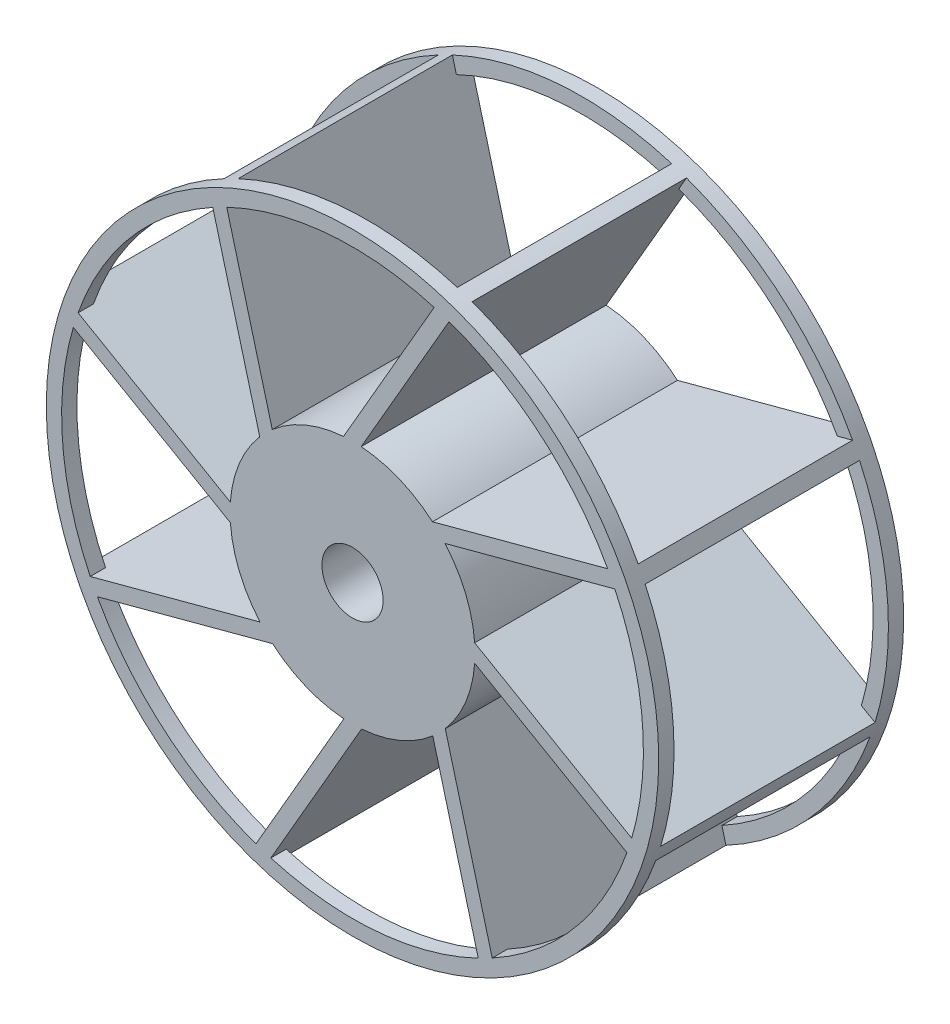
from build123d import *

# Parameters (mm, degrees)
SKETCH1_R           = 6.35
BOSS_EXTRUDE1_DEPTH = 50.8
BOSS_EXTRUDE2_START = -3.175
SKETCH2_R           = 63.5
SKETCH2_R_2         = 60.325
BOSS_EXTRUDE2_DEPTH = 3.175
SKETCH6_R           = 63.5
SKETCH6_R_2         = 60.325
BOSS_EXTRUDE3_DEPTH = 3.175
SKETCH1_3_R         = 6.35
CUT_EXTRUDE1_DEPTH  = 50.8


with BuildPart() as part:
    # Sketch1 → Boss-Extrude1 (new body)
    with BuildSketch(Plane.XY):
        Circle(SKETCH1_R)
        with BuildLine():
            Line((59.700240967, -21.63634046), (25.336398074, -1.796366515))
            ThreePointArc((25.336398074, -1.796366515), (-25.399970938, -0.03842333), (25.330847289, 1.873012441))
            Line((25.330847289, 1.873012441), (60.726284541, -18.562552784))
            ThreePointArc((60.726284541, -18.562552784), (60.232873534, -20.105992785), (59.700240967, -21.63634046))
        make_face()
        with BuildLine():
            Line((26.915242167, -57.513648286), (16.645315944, -19.185761833))
            ThreePointArc((16.645315944, -19.185761833), (-17.987661089, 17.933322295), (19.23603369, -16.587194093))
            Line((19.23603369, -16.587194093), (29.814260645, -56.065674545))
            ThreePointArc((29.814260645, -56.065674545), (28.373989485, -56.808157167), (26.915242167, -57.513648286))
        make_face()
        with BuildLine():
            Line((-21.63634046, -59.700240967), (-1.796366515, -25.336398074))
            ThreePointArc((-1.796366515, -25.336398074), (-0.03842333, 25.399970938), (1.873012441, -25.330847289))
            Line((1.873012441, -25.330847289), (-18.562552784, -60.726284541))
            ThreePointArc((-18.562552784, -60.726284541), (-20.105992785, -60.232873534), (-21.63634046, -59.700240967))
        make_face()
        with BuildLine():
            Line((-57.513648286, -26.915242167), (-19.185761833, -16.645315944))
            ThreePointArc((-19.185761833, -16.645315944), (17.933322295, 17.987661089), (-16.587194093, -19.23603369))
            Line((-16.587194093, -19.23603369), (-56.065674545, -29.814260645))
            ThreePointArc((-56.065674545, -29.814260645), (-56.808157167, -28.373989485), (-57.513648286, -26.915242167))
        make_face()
        with BuildLine():
            Line((-59.700240967, 21.63634046), (-25.336398074, 1.796366515))
            ThreePointArc((-25.336398074, 1.796366515), (25.399970938, 0.03842333), (-25.330847289, -1.873012441))
            Line((-25.330847289, -1.873012441), (-60.726284541, 18.562552784))
            ThreePointArc((-60.726284541, 18.562552784), (-60.232873534, 20.105992785), (-59.700240967, 21.63634046))
        make_face()
        with BuildLine():
            Line((-26.915242167, 57.513648286), (-16.645315944, 19.185761833))
            ThreePointArc((-16.645315944, 19.185761833), (17.987661089, -17.933322295), (-19.23603369, 16.587194093))
            Line((-19.23603369, 16.587194093), (-29.814260645, 56.065674545))
            ThreePointArc((-29.814260645, 56.065674545), (-28.373989485, 56.808157167), (-26.915242167, 57.513648286))
        make_face()
        with BuildLine():
            Line((21.63634046, 59.700240967), (1.796366515, 25.336398074))
            ThreePointArc((1.796366515, 25.336398074), (0.03842333, -25.399970938), (-1.873012441, 25.330847289))
            Line((-1.873012441, 25.330847289), (18.562552784, 60.726284541))
            ThreePointArc((18.562552784, 60.726284541), (20.105992785, 60.232873534), (21.63634046, 59.700240967))
        make_face()
        with BuildLine():
            Line((57.513648286, 26.915242167), (19.185761833, 16.645315944))
            ThreePointArc((19.185761833, 16.645315944), (-17.933322295, -17.987661089), (16.587194093, 19.23603369))
            Line((16.587194093, 19.23603369), (56.065674545, 29.814260645))
            ThreePointArc((56.065674545, 29.814260645), (56.808157167, 28.373989485), (57.513648286, 26.915242167))
        make_face()
    extrude(amount=BOSS_EXTRUDE1_DEPTH)

    # Sketch2 → Boss-Extrude2 (add)
    with BuildSketch(Plane.XY.offset(50.8).offset(BOSS_EXTRUDE2_START)):
        with Locations(Location((0, 0, 0), (0, 0, 163.002878163))):
            Circle(SKETCH2_R)
        Circle(SKETCH2_R_2, mode=Mode.SUBTRACT)
    extrude(amount=BOSS_EXTRUDE2_DEPTH)

    # Sketch6 → Boss-Extrude3 (add)
    with BuildSketch(Plane(origin=(0, 0, 0), x_dir=(-1, 0, 0), z_dir=(0, 0, -1))):
        with Locations(Location((0, 0, 0), (0, 0, 180))):
            Circle(SKETCH6_R)
        Circle(SKETCH6_R_2, mode=Mode.SUBTRACT)
    extrude(amount=-BOSS_EXTRUDE3_DEPTH)

    # Sketch1<3> → Cut-Extrude1 (cut)
    with BuildSketch(Plane.XY):
        Circle(SKETCH1_3_R)
    extrude(amount=CUT_EXTRUDE1_DEPTH, mode=Mode.SUBTRACT)


solid = part.part
